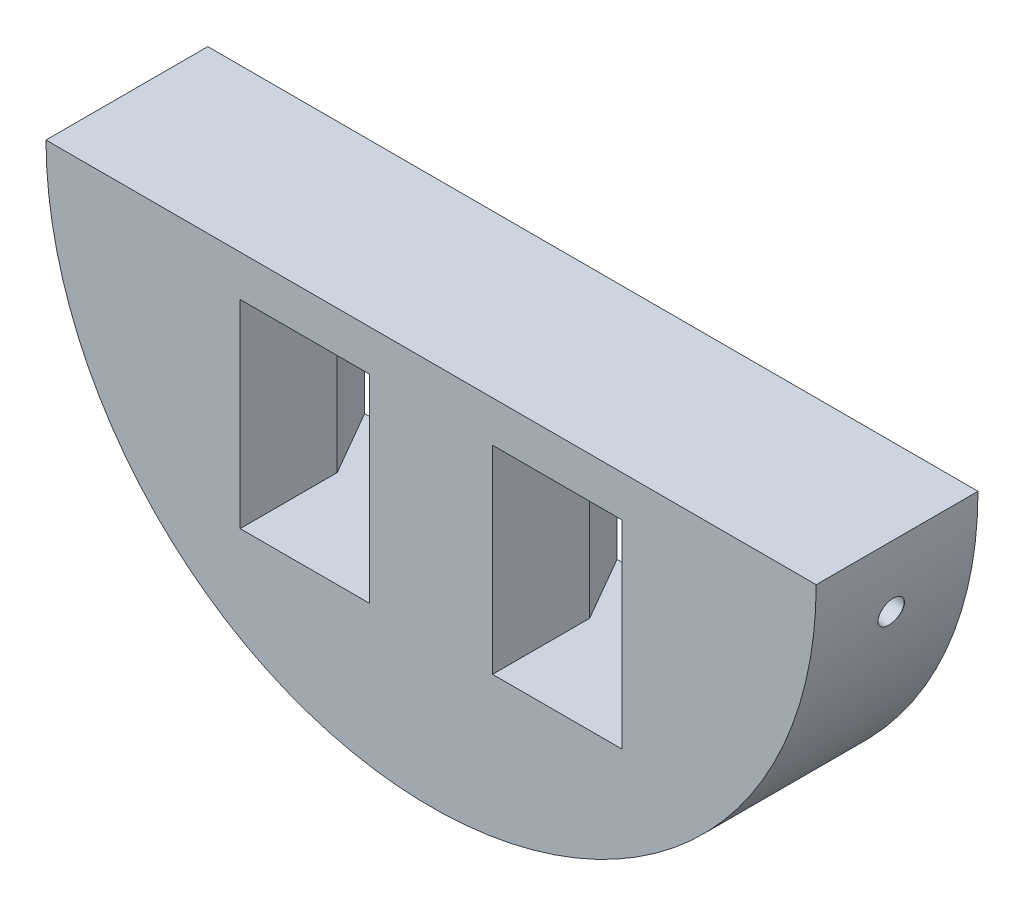
from build123d import *
from OCP.BRepFilletAPI import BRepFilletAPI_MakeChamfer

# Parameters (mm, degrees)
SKETCH1_W           = 20
SKETCH1_H           = 22
BOSS_EXTRUDE1_DEPTH = 25
CIRPATTERN1_COUNT   = 5
CIRPATTERN1_ANGLE   = 160
CHAMFER1_SIZE       = 15
CHAMFER1_SIZE2      = 8.660254038
CHAMFER2_SIZE       = 10
CHAMFER2_SIZE2      = 5.773502692


with BuildPart() as part:
    # Sketch1 → Boss-Extrude1 (new body)
    with BuildSketch(Plane.XY):
        with BuildLine():
            Line((-119, 0), (0, 0))
            ThreePointArc((0, 0), (-59.5, -59.5), (-119, 0))
        make_face()
        with Locations((-40, -26)):
            Rectangle(SKETCH1_W, SKETCH1_H, mode=Mode.SUBTRACT)
        with Locations((-79, -26)):
            Rectangle(SKETCH1_W, SKETCH1_H, mode=Mode.SUBTRACT)
    extrude(amount=BOSS_EXTRUDE1_DEPTH)

    # Sketch4 → Ø4.0mm Dowel Hole2 (revolve, cut)
    with BuildSketch(Plane(origin=(-0.903938696, -10.332066571, 12.5), x_dir=(0.1736481776669305, 0.9848077530122081, 0), z_dir=(0, 0, 1))):
        Polygon((0, 0), (0, 11.201721238), (2, 10), (2, 0.025), (2.025, 0), align=None)
    f_4_0mm_dowel_hole2 = revolve(axis=Axis((5.349590536, -11.434732499, 12.5), (-0.9848077530122081, 0.1736481776669305, 0)), mode=Mode.SUBTRACT)

    # CirPattern1: Ø4.0mm Dowel Hole2 ×5 about axis
    cirpattern1_axis = Axis((-59.5, 0, 0), (0, 0, -1))
    for i in range(1, CIRPATTERN1_COUNT):
        add(f_4_0mm_dowel_hole2.rotate(cirpattern1_axis, i * CIRPATTERN1_ANGLE / (CIRPATTERN1_COUNT - 1)), mode=Mode.SUBTRACT)

    # Chamfer1: one chamfer whose edges measure the first distance from different faces: ONE call of the kernel's chamfer builder (chamfer() names one face for all edges)
    chamfer1_edges_1 = [part.edges().sort_by_distance(p)[0] for p in [
        (-40, -15, 25),
    ]]
    chamfer1_side_1 = [part.faces().sort_by_distance(p)[0] for p in [
        (-40, -15, 12.5),
    ]]
    chamfer1_edges_2 = [part.edges().sort_by_distance(p)[0] for p in [
        (-79, -15, 25),
    ]]
    chamfer1_side_2 = [part.faces().sort_by_distance(p)[0] for p in [
        (-79, -15, 12.5),
    ]]
    chamfer1 = BRepFilletAPI_MakeChamfer(part.part.solid().wrapped)
    for e in chamfer1_edges_1:
        chamfer1.Add(CHAMFER1_SIZE, CHAMFER1_SIZE2, e.wrapped, chamfer1_side_1[0].wrapped)  # the first distance lies on this face
    for e in chamfer1_edges_2:
        chamfer1.Add(CHAMFER1_SIZE, CHAMFER1_SIZE2, e.wrapped, chamfer1_side_2[0].wrapped)  # the first distance lies on this face
    add(Compound.cast(chamfer1.Shape()), mode=Mode.REPLACE)

    # Chamfer2: one chamfer whose edges measure the first distance from different faces: ONE call of the kernel's chamfer builder (chamfer() names one face for all edges)
    chamfer2_edges_1 = [part.edges().sort_by_distance(p)[0] for p in [
        (-50, -26, 0),
    ]]
    chamfer2_side_1 = [part.faces().sort_by_distance(p)[0] for p in [
        (-50, -24.533265853, 13.292158355),
    ]]
    chamfer2_edges_2 = [part.edges().sort_by_distance(p)[0] for p in [
        (-30, -26, 0),
    ]]
    chamfer2_side_2 = [part.faces().sort_by_distance(p)[0] for p in [
        (-30, -24.533265853, 13.292158355),
    ]]
    chamfer2_edges_3 = [part.edges().sort_by_distance(p)[0] for p in [
        (-89, -26, 0),
    ]]
    chamfer2_side_3 = [part.faces().sort_by_distance(p)[0] for p in [
        (-89, -24.533265853, 13.292158355),
    ]]
    chamfer2_edges_4 = [part.edges().sort_by_distance(p)[0] for p in [
        (-69, -26, 0),
    ]]
    chamfer2_side_4 = [part.faces().sort_by_distance(p)[0] for p in [
        (-69, -24.533265853, 13.292158355),
    ]]
    chamfer2 = BRepFilletAPI_MakeChamfer(part.part.solid().wrapped)
    for e in chamfer2_edges_1:
        chamfer2.Add(CHAMFER2_SIZE, CHAMFER2_SIZE2, e.wrapped, chamfer2_side_1[0].wrapped)  # the first distance lies on this face
    for e in chamfer2_edges_2:
        chamfer2.Add(CHAMFER2_SIZE, CHAMFER2_SIZE2, e.wrapped, chamfer2_side_2[0].wrapped)  # the first distance lies on this face
    for e in chamfer2_edges_3:
        chamfer2.Add(CHAMFER2_SIZE, CHAMFER2_SIZE2, e.wrapped, chamfer2_side_3[0].wrapped)  # the first distance lies on this face
    for e in chamfer2_edges_4:
        chamfer2.Add(CHAMFER2_SIZE, CHAMFER2_SIZE2, e.wrapped, chamfer2_side_4[0].wrapped)  # the first distance lies on this face
    add(Compound.cast(chamfer2.Shape()), mode=Mode.REPLACE)


solid = part.part
